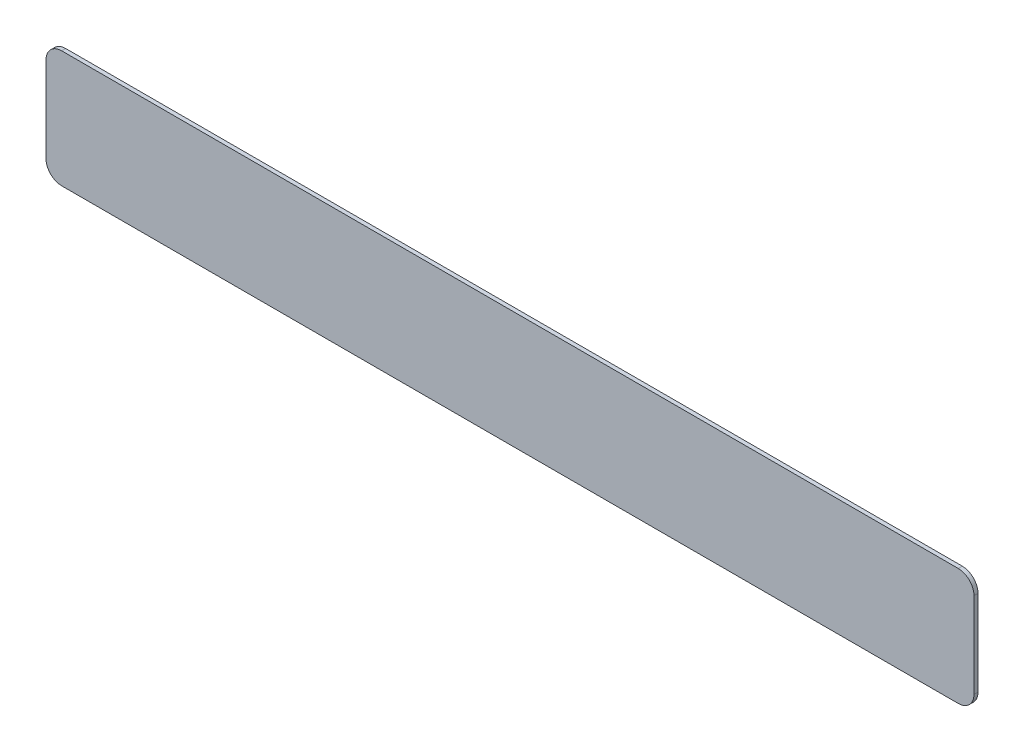
from build123d import *

# Parameters (mm, degrees)
BOSS_EXTRUDE1_DEPTH = 0.32


with BuildPart() as part:
    # Sketch1 → Boss-Extrude1 (new body)
    with BuildSketch(Plane.XY):
        with BuildLine():
            Line((-35.65, 4.65), (35.65, 4.65))
            ThreePointArc((35.65, 4.65), (36.533883476, 4.283883476), (36.9, 3.4))
            Line((36.9, 3.4), (36.9, -3.4))
            ThreePointArc((36.9, -3.4), (36.533883476, -4.283883476), (35.65, -4.65))
            Line((35.65, -4.65), (-35.65, -4.65))
            ThreePointArc((-35.65, -4.65), (-36.533883476, -4.283883476), (-36.9, -3.4))
            Line((-36.9, -3.4), (-36.9, 3.4))
            ThreePointArc((-36.9, 3.4), (-36.533883476, 4.283883476), (-35.65, 4.65))
        make_face()
    extrude(amount=BOSS_EXTRUDE1_DEPTH)


solid = part.part
